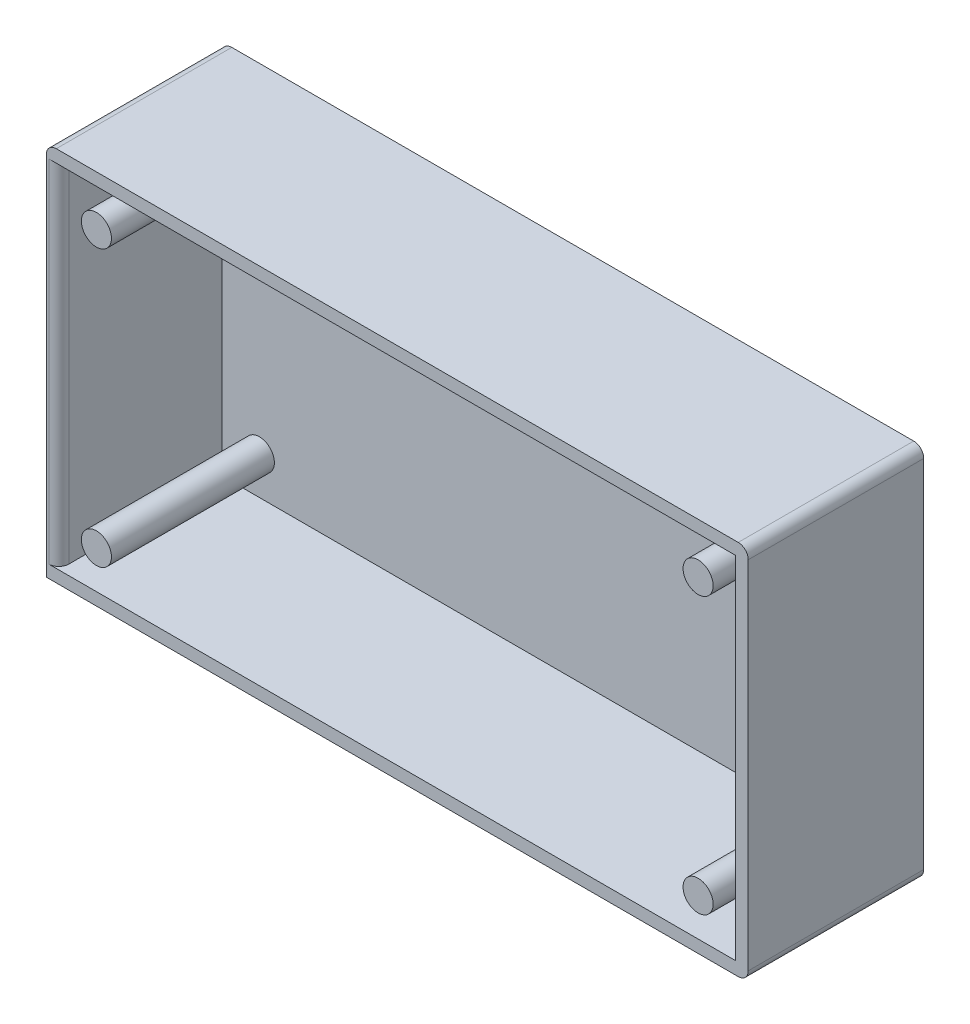
from build123d import *

# Parameters (mm, degrees)
SKETCH1_W           = 140
SKETCH1_H           = 75
BOSS_EXTRUDE1_DEPTH = 35
SHELL1_T            = -2.5
SKETCH2_R           = 3
BOSS_EXTRUDE2_DEPTH = 32.5
SKETCH3_R           = 2.25
SKETCH3_R_2         = 2.5
CUT_EXTRUDE1_DEPTH  = 35
FILLET1_R           = 2


with BuildPart() as part:
    # Sketch1 → Boss-Extrude1 (new body)
    with BuildSketch(Plane.XY):
        Rectangle(SKETCH1_W, SKETCH1_H)
    extrude(amount=BOSS_EXTRUDE1_DEPTH)

    # Shell1
    shell1_openings = [part.faces().sort_by_distance(p)[0] for p in [
        (0, 0, 35),
    ]]
    offset(amount=SHELL1_T, openings=shell1_openings, kind=Kind.INTERSECTION)

    # Sketch2 → Boss-Extrude2 (add)
    with BuildSketch(Plane.XY.offset(2.5)):
        with Locations(Location((-60, -27.5, 0), (0, 0, 180))):
            Circle(SKETCH2_R)
        with Locations(Location((60, -27.5, 0), (0, 0, 180))):
            Circle(SKETCH2_R)
        with Locations(Location((-60, 27.5, 0), (0, 0, 180))):
            Circle(SKETCH2_R)
        with Locations(Location((60, 27.5, 0), (0, 0, 180))):
            Circle(SKETCH2_R)
    extrude(amount=BOSS_EXTRUDE2_DEPTH)

    # Sketch3 → Cut-Extrude1 (cut)
    with BuildSketch(Plane.XY):
        with Locations(Location((-65, -32.5, 0), (0, 0, 180))):
            Circle(SKETCH3_R)
        with Locations((65, -32.5)):
            Circle(SKETCH3_R_2)
        with Locations(Location((-65, 32.5, 0), (0, 0, 180))):
            Circle(SKETCH3_R)
        with Locations((65, 32.5)):
            Circle(SKETCH3_R_2)
    extrude(amount=CUT_EXTRUDE1_DEPTH, mode=Mode.SUBTRACT)

    # Fillet1
    fillet1_edges = [part.edges().sort_by_distance(p)[0] for p in [
        (-67.5, 0, 35),
        (70, -37.5, 17.5),
        (-70, 37.5, 17.5),
        (70, 37.5, 17.5),
    ]]
    fillet(fillet1_edges, radius=FILLET1_R)


solid = part.part
